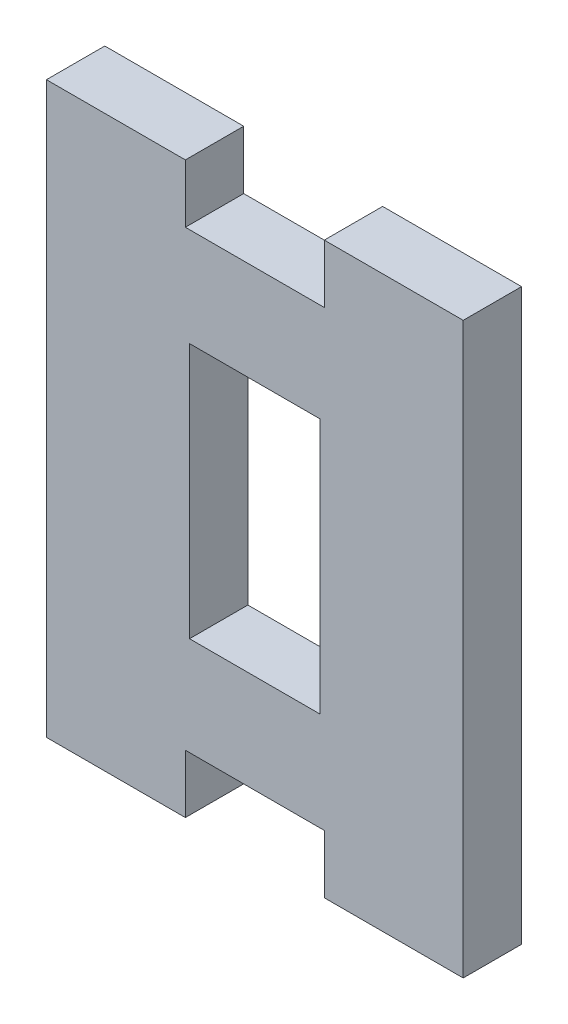
from build123d import *

# Parameters (mm, degrees)
SKETCH1_W           = 38.1
SKETCH1_H           = 52.07
BOSS_EXTRUDE1_DEPTH = 5.334
SKETCH2_W           = 11.938
SKETCH2_H           = 23.368
CUT_EXTRUDE1_DEPTH  = 54.818475018
SKETCH3_W           = 12.7
SKETCH3_H           = 5.334
CUT_EXTRUDE2_DEPTH  = 54.818475018


with BuildPart() as part:
    # Sketch1 → Boss-Extrude1 (new body)
    with BuildSketch(Plane.XY):
        with Locations((4.493611175, -22.065676399)):
            Rectangle(SKETCH1_W, SKETCH1_H)
    extrude(amount=BOSS_EXTRUDE1_DEPTH)

    # Sketch2 → Cut-Extrude1 (cut, through all)
    with BuildSketch(Plane.XY.offset(5.334)):
        with Locations((4.493611175, -22.065676399)):
            Rectangle(SKETCH2_W, SKETCH2_H)
    extrude(amount=-CUT_EXTRUDE1_DEPTH, mode=Mode.SUBTRACT)

    # Sketch3 → Cut-Extrude2 (cut, through all)
    with BuildSketch(Plane.XY.offset(5.334)):
        with Locations((4.493611175, 1.302323601)):
            Rectangle(SKETCH3_W, SKETCH3_H)
        with Locations((4.493611175, -45.433676399)):
            Rectangle(SKETCH3_W, SKETCH3_H)
    extrude(amount=-CUT_EXTRUDE2_DEPTH, mode=Mode.SUBTRACT)


solid = part.part
